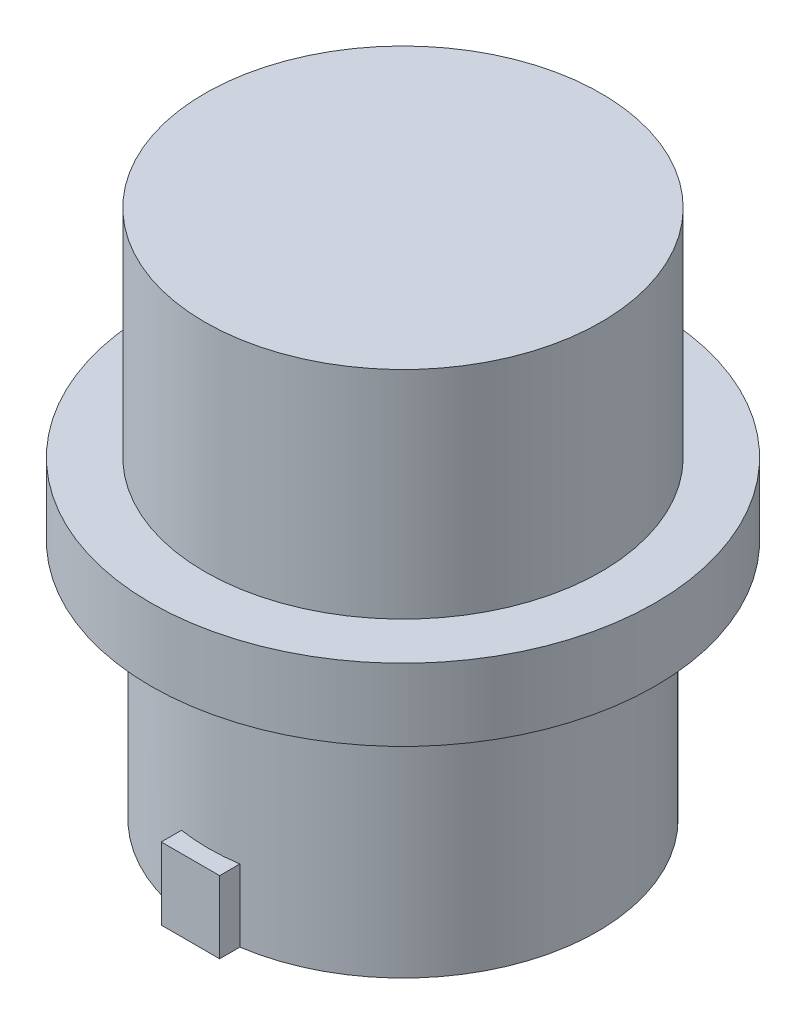
from build123d import *

# Parameters (mm, degrees)
SKIZZE2_R                       = 7
AUFSATZ_LINEAR_AUSTRAGEN2_DEPTH = 2
SKIZZE4_R                       = 5.5
AUFSATZ_LINEAR_AUSTRAGEN3_DEPTH = 6
SKIZZE5_R                       = 5.4
AUFSATZ_LINEAR_AUSTRAGEN4_DEPTH = 6.7
SKIZZE7_W                       = 1.619965962
SKIZZE7_H                       = 1
AUFSATZ_LINEAR_AUSTRAGEN5_DEPTH = 2


with BuildPart() as part:
    # Skizze2 → Aufsatz-Linear austragen2 (new body)
    with BuildSketch(Plane(origin=(0, 0, 0), x_dir=(1, 0, 0), z_dir=(0, 1, 0))):
        with Locations(Location((0, 0, 0), (0, 0, 270))):
            Circle(SKIZZE2_R)
    extrude(amount=AUFSATZ_LINEAR_AUSTRAGEN2_DEPTH)

    # Skizze4 → Aufsatz-Linear austragen3 (add)
    with BuildSketch(Plane(origin=(0, 2, 0), x_dir=(1, 0, 0), z_dir=(0, 1, 0))):
        with Locations(Location((0, 0, 0), (0, 0, 270))):
            Circle(SKIZZE4_R)
    extrude(amount=AUFSATZ_LINEAR_AUSTRAGEN3_DEPTH)

    # Skizze5 → Aufsatz-Linear austragen4 (add)
    with BuildSketch(Plane(origin=(0, 0, 0), x_dir=(-1, 0, 0), z_dir=(0, -1, 0))):
        with Locations(Location((0, 0, 0), (0, 0, 90))):
            Circle(SKIZZE5_R)
    extrude(amount=AUFSATZ_LINEAR_AUSTRAGEN4_DEPTH)

    # Skizze7 → Aufsatz-Linear austragen5 (add)
    with BuildSketch(Plane.XZ.offset(6.7)):
        with Locations((0, 5.4)):
            Rectangle(SKIZZE7_W, SKIZZE7_H)
    extrude(amount=-AUFSATZ_LINEAR_AUSTRAGEN5_DEPTH)


solid = part.part
